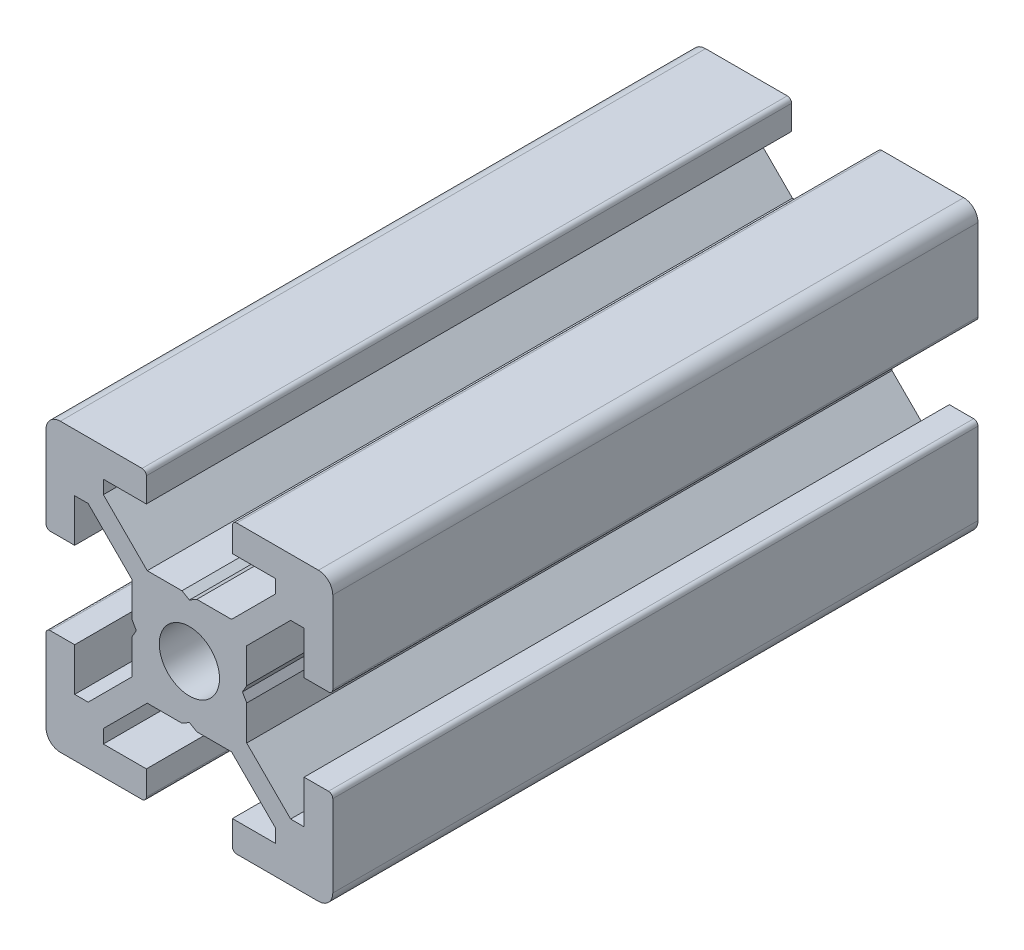
from build123d import *

# Parameters (mm, degrees)
BOSS_EXTRUDE1_DEPTH = 45
SKETCH2_W           = 400
SKETCH2_H           = 2.1


with BuildPart() as part:
    # Sketch1 → Boss-Extrude1 (new body)
    with BuildSketch(Plane.XY):
        with BuildLine():
            Line((-10, 9), (-10, 3.29999995))
            ThreePointArc((-10, 3.29999995), (-9.912132049, 3.087867916), (-9.7, 3))
            Line((-9.7, 3), (-8, 3))
            Line((-8, 3), (-8, 6))
            Line((-8, 6), (-7.060677, 6))
            Line((-7.060677, 6), (-4, 2.93932965))
            Line((-4, 2.93932965), (-4, 0.519615242))
            Line((-4, 0.519615242), (-3.699996283, -6.437e-06))
            Line((-3.699996283, -6.437e-06), (-4, -0.519628117))
            Line((-4, -0.519628117), (-4, -2.93933725))
            Line((-4, -2.93933725), (-7.0606695, -6))
            Line((-7.0606695, -6), (-8, -6))
            Line((-8, -6), (-8, -3))
            Line((-8, -3), (-9.7, -3))
            ThreePointArc((-9.7, -3), (-9.912132049, -3.087867916), (-10, -3.29999995))
            Line((-10, -3.29999995), (-10, -9))
            ThreePointArc((-10, -9), (-9.707106781, -9.707106781), (-9, -10))
            Line((-9, -10), (-3.29999995, -10))
            ThreePointArc((-3.29999995, -10), (-3.087867916, -9.912132049), (-3, -9.7))
            Line((-3, -9.7), (-3, -8))
            Line((-3, -8), (-6, -8))
            Line((-6, -8), (-6, -7.0606515))
            Line((-6, -7.0606515), (-2.9393489, -4))
            Line((-2.9393489, -4), (-0.519615242, -4))
            Line((-0.519615242, -4), (6.437e-06, -3.699996283))
            Line((6.437e-06, -3.699996283), (0.519628117, -4))
            Line((0.519628117, -4), (2.9393227, -4))
            Line((2.9393227, -4), (6, -7.060677))
            Line((6, -7.060677), (6, -8))
            Line((6, -8), (3, -8))
            Line((3, -8), (3, -9.7))
            ThreePointArc((3, -9.7), (3.087867916, -9.912132049), (3.29999995, -10))
            Line((3.29999995, -10), (9, -10))
            ThreePointArc((9, -10), (9.707106781, -9.707106781), (10, -9))
            Line((10, -9), (10, -3.29999995))
            ThreePointArc((10, -3.29999995), (9.912132049, -3.087867916), (9.7, -3))
            Line((9.7, -3), (8, -3))
            Line((8, -3), (8, -6))
            Line((8, -6), (7.0606435, -6))
            Line((7.0606435, -6), (4, -2.9393482))
            Line((4, -2.9393482), (4, -0.519615242))
            Line((4, -0.519615242), (3.699996283, 6.437e-06))
            Line((3.699996283, 6.437e-06), (4, 0.519628117))
            Line((4, 0.519628117), (4, 2.9393401))
            Line((4, 2.9393401), (7.060651, 6))
            Line((7.060651, 6), (8, 6))
            Line((8, 6), (8, 3))
            Line((8, 3), (9.7, 3))
            ThreePointArc((9.7, 3), (9.912132049, 3.087867916), (10, 3.29999995))
            Line((10, 3.29999995), (10, 9))
            ThreePointArc((10, 9), (9.707106781, 9.707106781), (9, 10))
            Line((9, 10), (3.29999995, 10))
            ThreePointArc((3.29999995, 10), (3.087867916, 9.912132049), (3, 9.7))
            Line((3, 9.7), (3, 8))
            Line((3, 8), (6, 8))
            Line((6, 8), (6, 7.060669))
            Line((6, 7.060669), (2.9393308, 4))
            Line((2.9393308, 4), (0.519615242, 4))
            Line((0.519615242, 4), (-6.437e-06, 3.699996283))
            Line((-6.437e-06, 3.699996283), (-0.519628117, 4))
            Line((-0.519628117, 4), (-2.93935655, 4))
            Line((-2.93935655, 4), (-6, 7.0606435))
            Line((-6, 7.0606435), (-6, 8))
            Line((-6, 8), (-3, 8))
            Line((-3, 8), (-3, 9.7))
            ThreePointArc((-3, 9.7), (-3.087867966, 9.912132034), (-3.3, 10))
            Line((-3.3, 10), (-9, 10))
            ThreePointArc((-9, 10), (-9.707106781, 9.707106781), (-10, 9))
        make_face()
    extrude(amount=-BOSS_EXTRUDE1_DEPTH)

    # Sketch2 → Cut-Revolve1 (revolve, cut)
    with BuildSketch(Plane(origin=(0, 0, 0), x_dir=(0, 0, -1), z_dir=(1, 0, 0)), mode=Mode.PRIVATE) as cut_revolve1_sk:
        with Locations((200, 1.05)):
            Rectangle(SKETCH2_W, SKETCH2_H)
    revolve(cut_revolve1_sk.sketch.rotate(Axis((0, 0, -400), (0, 0, 1)), 270), axis=Axis((0, 0, -400), (0, 0, 1)), mode=Mode.SUBTRACT)


solid = part.part
